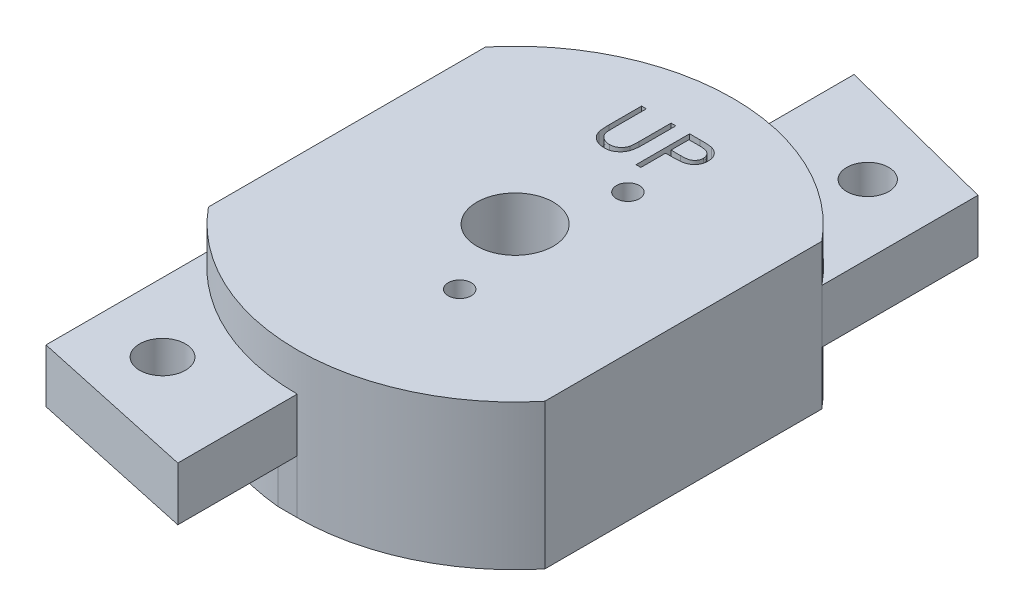
from build123d import *

# Parameters (mm, degrees)
SKETCH1_R           = 2.5
SKETCH1_R_2         = 0.75
BOSS_EXTRUDE1_DEPTH = 6
SKETCH2_R           = 1.373718665
SKETCH2_R_2         = 1.5
BOSS_EXTRUDE4_DEPTH = 3.5
CUT_EXTRUDE1_DEPTH  = 1
SKETCH6_R           = 0.75
SKETCH6_R_2         = 2.5
BOSS_EXTRUDE6_DEPTH = 3.5


with BuildPart() as part:
    # Sketch1 → Boss-Extrude1 (new body)
    with BuildSketch(Plane(origin=(0, 0, 0), x_dir=(1, 0, 0), z_dir=(0, 1, 0))):
        with BuildLine():
            Line((0, 5.191164534), (0, 23.308835466))
            ThreePointArc((0, 23.308835466), (11, 28.5), (22, 23.308835466))
            Line((22, 23.308835466), (22, 5.191164534))
            ThreePointArc((22, 5.191164534), (11, 0), (0, 5.191164534))
        make_face()
        with Locations(Location((11, 14.25, 0), (0, 0, 270))):
            Circle(SKETCH1_R, mode=Mode.SUBTRACT)
        with Locations(Location((12.875414144, 8.75, 0), (0, 0, 270))):
            Circle(SKETCH1_R_2, mode=Mode.SUBTRACT)
        with Locations(Location((12.875414144, 19.75, 0), (0, 0, 270))):
            Circle(SKETCH1_R_2, mode=Mode.SUBTRACT)
    extrude(amount=BOSS_EXTRUDE1_DEPTH)

    # Sketch2 → Boss-Extrude4 (add)
    # profile 1 of 2: a face of its own
    with BuildSketch(Plane(origin=(0, 0, 0), x_dir=(1, 0, 0), z_dir=(0, 1, 0))):
        with BuildLine():
            ThreePointArc((22, 23.308835466), (17.1460404, 27.154557663), (11.107071071, 28.526181686))
            Line((11.107071071, 28.526181686), (11.107071071, 36.308835466))
            Line((11.107071071, 36.308835466), (22, 33.519158942))
            Line((22, 33.519158942), (22, 23.308835466))
        make_face()
        with Locations(Location((17.5, 30.808835466, 0), (0, 0, 270))):
            Circle(SKETCH2_R, mode=Mode.SUBTRACT)
    # profile 2 of 2: a face of its own
    with BuildSketch(Plane(origin=(0, 0, 0), x_dir=(1, 0, 0), z_dir=(0, 1, 0))):
        with BuildLine():
            Line((0, -5.429149349), (11, -7.808835466))
            Line((11, -7.808835466), (11, 0))
            ThreePointArc((11, 0), (4.93641478, 1.373255983), (0, 5.152767438))
            Line((0, 5.152767438), (0, -5.429149349))
        make_face()
        with Locations(Location((4.5, -2.308835466, 0), (0, 0, 270))):
            Circle(SKETCH2_R_2, mode=Mode.SUBTRACT)
    extrude(amount=BOSS_EXTRUDE4_DEPTH)


with BuildPart() as boss_extrude4_piece_1:
    # of the separate pieces the step leaves, piece 1, a body of its own (boss_extrude4_pieces)
    add(part.part.solids().sort_by_distance((0, 0, -5.191164534))[0])

    # Sketch4 → Cut-Extrude1 (cut)
    # profile 1 of 2: a face of its own
    with BuildSketch(Plane(origin=(0, 6, 0), x_dir=(1, 0, 0), z_dir=(0, 1, 0))):
        with BuildLine():
            Line((8.446641059, 25.071391599), (8.760743623, 25.071391599))
            Line((8.760743623, 25.071391599), (8.760743623, 22.974336311))
            add(Edge.make_bspline(
                [(8.760743623, 22.974336311), (8.760696879, 22.944655575), (8.760608174, 22.888331264), (8.761200688, 22.808162964), (8.762860056, 22.736890505), (8.763906216, 22.674239157), (8.766233549, 22.620496409), (8.768131596, 22.575371099), (8.770572153, 22.539076896), (8.773505271, 22.51789597), (8.774766059, 22.508791439)],
                knots=[0, 0, 0, 0, 1.528628734, 2.90083645, 4.128790002, 5.200304208, 6.127813768, 6.898992206, 7.526736466, 8, 8, 8, 8], degree=3))
            add(Edge.make_bspline(
                [(8.774766059, 22.508791439), (8.779943517, 22.475944676), (8.790006704, 22.412101947), (8.815653082, 22.321193665), (8.851470583, 22.239262206), (8.893913625, 22.163750915), (8.949846237, 22.096761555), (9.016849772, 22.035049902), (9.09802754, 21.981078098), (9.188288146, 21.931727286), (9.285573384, 21.892062204), (9.38498465, 21.862068839), (9.485027629, 21.843789939), (9.552003794, 21.841673401), (9.585262854, 21.840622368)],
                knots=[0, 0, 0, 0, 1.035780045, 2.013197591, 2.933192213, 3.817615948, 4.702609284, 5.640816605, 6.646850145, 7.73207398, 8.84249596, 9.914020372, 10.964143139, 12, 12, 12, 12], degree=3))
            add(Edge.make_bspline(
                [(9.585262854, 21.840622368), (9.613816594, 21.841696219), (9.670759156, 21.843837717), (9.755365586, 21.857099148), (9.837765695, 21.880999714), (9.918366375, 21.911839472), (9.993917359, 21.952587063), (10.064460801, 21.999657903), (10.127424736, 22.054868779), (10.184882734, 22.115969123), (10.234917669, 22.184908923), (10.278288811, 22.260187061), (10.313814741, 22.342936408), (10.331358265, 22.40109083), (10.340371027, 22.43096692)],
                knots=[0, 0, 0, 0, 0.994687771, 1.983630487, 2.973142513, 3.978332533, 4.983357753, 5.956394766, 6.925816176, 7.893390482, 8.871859704, 9.88551698, 10.913711441, 12, 12, 12, 12], degree=3))
            add(Edge.make_bspline(
                [(10.340371027, 22.43096692), (10.343371152, 22.443315494), (10.35005664, 22.470833094), (10.356303685, 22.517354385), (10.36281021, 22.572243749), (10.36732478, 22.635895562), (10.371726001, 22.708096534), (10.374359074, 22.789222792), (10.375576107, 22.878979752), (10.375938787, 22.941616914), (10.376128238, 22.974336311)],
                knots=[0, 0, 0, 0, 0.558680831, 1.244966039, 2.062412453, 2.990489873, 4.051219941, 5.244515665, 6.560634259, 8, 8, 8, 8], degree=3))
            Line((10.376128238, 22.974336311), (10.376128238, 25.071391599))
            Line((10.376128238, 25.071391599), (10.690230802, 25.071391599))
            Line((10.690230802, 25.071391599), (10.690230802, 22.957509388))
            add(Edge.make_bspline(
                [(10.690230802, 22.957509388), (10.689976682, 22.919411009), (10.68948075, 22.845059706), (10.685180174, 22.736108347), (10.678323174, 22.632755366), (10.668635086, 22.534986869), (10.655798083, 22.44315271), (10.641522862, 22.356447942), (10.623343329, 22.275494949), (10.602109928, 22.199662531), (10.57783638, 22.127477018), (10.546395232, 22.058968403), (10.510970732, 21.992054004), (10.468956079, 21.927745895), (10.421744696, 21.865759342), (10.368293016, 21.806470267), (10.310368855, 21.74893122), (10.247009295, 21.694618154), (10.17925877, 21.644809477), (10.107318812, 21.601011706), (10.031742042, 21.563988089), (9.952724916, 21.533512164), (9.870233713, 21.510597565), (9.784266354, 21.493522409), (9.69462716, 21.483820112), (9.633662504, 21.482378182), (9.602790898, 21.48164801)],
                knots=[0, 0, 0, 0, 1.316592851, 2.569410997, 3.76748051, 4.895814652, 5.963796859, 6.97159953, 7.931736103, 8.829262218, 9.692595152, 10.560224239, 11.431080259, 12.30701507, 13.211635791, 14.121146779, 15.063487852, 16.031507147, 17.00238618, 17.966455255, 18.938106653, 19.907068911, 20.888905087, 21.893141452, 22.933117798, 24, 24, 24, 24], degree=3))
            add(Edge.make_bspline(
                [(9.602790898, 21.48164801), (9.569121796, 21.482432775), (9.503063137, 21.483972481), (9.40572507, 21.492795232), (9.312410873, 21.509413626), (9.222134996, 21.53057357), (9.136126499, 21.559757307), (9.053233055, 21.593855432), (8.974874374, 21.635732692), (8.899779245, 21.682326085), (8.829954489, 21.734750723), (8.765857086, 21.791890897), (8.707381215, 21.852831275), (8.655512519, 21.91823164), (8.609391634, 21.987583347), (8.569661421, 22.061082587), (8.535548177, 22.138700903), (8.51794161, 22.192654104), (8.509040898, 22.21992926)],
                knots=[0, 0, 0, 0, 1.13879206, 2.234305948, 3.301075583, 4.341971843, 5.366689343, 6.369221514, 7.369726634, 8.367512178, 9.355451585, 10.318319045, 11.268648973, 12.207971039, 13.137398894, 14.081662264, 15.030215811, 16, 16, 16, 16], degree=3))
            add(Edge.make_bspline(
                [(8.509040898, 22.21992926), (8.50386374, 22.238561834), (8.492634369, 22.278976303), (8.480609071, 22.345862791), (8.47049999, 22.422877709), (8.460994431, 22.510026327), (8.455385473, 22.607376194), (8.450468035, 22.71488511), (8.446606416, 22.832683072), (8.446629188, 22.914737587), (8.446641059, 22.957509388)],
                knots=[0, 0, 0, 0, 0.625038921, 1.35572334, 2.194682327, 3.136881307, 4.189498639, 5.346923369, 6.617055217, 8, 8, 8, 8], degree=3))
            Line((8.446641059, 22.957509388), (8.446641059, 25.071391599))
        make_face()
    # profile 2 of 2: a face of its own
    with BuildSketch(Plane(origin=(0, 6, 0), x_dir=(1, 0, 0), z_dir=(0, 1, 0))):
        with BuildLine():
            Line((11.5876667, 25.071391599), (12.274064937, 25.071391599))
            add(Edge.make_bspline(
                [(12.274064937, 25.071391599), (12.321275843, 25.071339703), (12.411734036, 25.071240268), (12.541449092, 25.068225522), (12.659258823, 25.06419883), (12.764909204, 25.058616936), (12.858725302, 25.052020346), (12.940282602, 25.042768307), (13.010222158, 25.033108011), (13.052128607, 25.023286605), (13.071240418, 25.018807465)],
                knots=[0, 0, 0, 0, 1.415646017, 2.712440637, 3.8905458, 4.950247383, 5.884950622, 6.709939814, 7.411656543, 8, 8, 8, 8], degree=3))
            add(Edge.make_bspline(
                [(13.071240418, 25.018807465), (13.095433951, 25.012185515), (13.143250929, 24.999097653), (13.212151972, 24.97288393), (13.277705817, 24.941801764), (13.340137376, 24.906377825), (13.398679459, 24.86509226), (13.4542055, 24.819618643), (13.50622548, 24.768907074), (13.554446872, 24.713526334), (13.598731669, 24.654406124), (13.636861352, 24.590663894), (13.668788579, 24.523372591), (13.696171851, 24.45257902), (13.715880305, 24.377688696), (13.730727205, 24.299221984), (13.740150832, 24.217187294), (13.741053394, 24.161127426), (13.741512854, 24.132589516)],
                knots=[0, 0, 0, 0, 0.999701418, 1.975846123, 2.934577507, 3.890451536, 4.834027766, 5.787354733, 6.749476667, 7.726910423, 8.712836071, 9.690891519, 10.682875813, 11.679750201, 12.712814741, 13.765529915, 14.8625177, 16, 16, 16, 16], degree=3))
            add(Edge.make_bspline(
                [(13.741512854, 24.132589516), (13.741091429, 24.103811739), (13.740266883, 24.047506075), (13.730370598, 23.965133287), (13.717040406, 23.886414897), (13.696543354, 23.811525446), (13.66969768, 23.740909676), (13.638205628, 23.673488444), (13.600222097, 23.610408772), (13.556577268, 23.551441654), (13.508025673, 23.496531742), (13.454772735, 23.446076948), (13.397033443, 23.400372609), (13.334991294, 23.359316266), (13.268041446, 23.323859986), (13.197199292, 23.292102681), (13.121849076, 23.26543162), (13.069706562, 23.251401559), (13.043195546, 23.244268202)],
                knots=[0, 0, 0, 0, 1.121902311, 2.195077645, 3.232258892, 4.234102512, 5.217864754, 6.176164875, 7.132989551, 8.084763148, 9.034132444, 9.988522005, 10.94243251, 11.903244335, 12.886203696, 13.894208494, 14.929344452, 16, 16, 16, 16], degree=3))
            add(Edge.make_bspline(
                [(13.043195546, 23.244268202), (13.021268212, 23.239605221), (12.973213184, 23.229386027), (12.894070462, 23.21797757), (12.801925076, 23.208239969), (12.696902796, 23.200938831), (12.579097892, 23.194688463), (12.448446634, 23.189720369), (12.304692557, 23.186990515), (12.204421313, 23.186849722), (12.152069745, 23.186776215)],
                knots=[0, 0, 0, 0, 0.601384939, 1.31797006, 2.144135048, 3.087295005, 4.142315834, 5.309527816, 6.595305764, 8, 8, 8, 8], degree=3))
            Line((12.152069745, 23.186776215), (11.901769264, 23.186776215))
            Line((11.901769264, 23.186776215), (11.901769264, 21.571391599))
            Line((11.901769264, 21.571391599), (11.5876667, 21.571391599))
            Line((11.5876667, 21.571391599), (11.5876667, 25.071391599))
        make_face()
        with BuildLine():
            Line((11.901769264, 24.71241724), (11.901769264, 23.545750574))
            Line((11.901769264, 23.545750574), (12.514549712, 23.538038234))
            add(Edge.make_bspline(
                [(12.514549712, 23.538038234), (12.544469638, 23.53802277), (12.602229438, 23.537992918), (12.685665661, 23.541978142), (12.763074949, 23.546578674), (12.834219524, 23.553314598), (12.899131459, 23.562835855), (12.957918988, 23.572447593), (13.01012627, 23.586352956), (13.071225472, 23.605076025), (13.13930882, 23.637008641), (13.213376368, 23.683358531), (13.276146955, 23.742439239), (13.330465251, 23.80886707), (13.373571129, 23.8827662), (13.405127122, 23.961835136), (13.423668279, 24.045262986), (13.426154473, 24.102351125), (13.427410289, 24.131187272)],
                knots=[0, 0, 0, 0, 1.160613943, 2.240541288, 3.23993089, 4.169200891, 5.011653406, 5.7853311, 6.478053781, 7.106038997, 8.262395093, 9.384106736, 10.481365981, 11.59014053, 12.70357646, 13.786202915, 14.881775077, 16, 16, 16, 16], degree=3))
            add(Edge.make_bspline(
                [(13.427410289, 24.131187272), (13.426147643, 24.159325786), (13.423637658, 24.215261668), (13.404981795, 24.297240429), (13.373632481, 24.375476133), (13.330175886, 24.448449218), (13.277434756, 24.514638022), (13.216135413, 24.572135149), (13.146422152, 24.618356852), (13.081573921, 24.648190134), (13.023972735, 24.666405409), (12.973940775, 24.67915025), (12.917450101, 24.689325856), (12.854482321, 24.697565359), (12.785525487, 24.70461882), (12.709987172, 24.709404797), (12.628153529, 24.712206253), (12.571342958, 24.712345209), (12.541893462, 24.71241724)],
                knots=[0, 0, 0, 0, 1.120700087, 2.227813068, 3.331159281, 4.466773991, 5.599788987, 6.693661531, 7.80175334, 8.91857717, 9.525282508, 10.207424825, 10.974604443, 11.810962634, 12.737642355, 13.736264703, 14.826523623, 16, 16, 16, 16], degree=3))
            Line((12.541893462, 24.71241724), (11.901769264, 24.71241724))
        make_face(mode=Mode.SUBTRACT)
    extrude(amount=-CUT_EXTRUDE1_DEPTH, mode=Mode.SUBTRACT)

    # Sketch6 → Boss-Extrude6 (add)
    with BuildSketch(Plane.XZ):
        with BuildLine():
            ThreePointArc((22, -5.191164534), (17.081697732, -1.362973473), (11, 0))
            Line((11, 0), (9.752952518, 0))
            ThreePointArc((9.752952518, 0), (4.362038706, -1.583134835), (0, -5.124446168))
            Line((0, -5.124446168), (0, -5.152767438))
            ThreePointArc((0, -5.152767438), (0.901977749, -4.179926091), (1.888834821, -3.293304828))
            ThreePointArc((1.888834821, -3.293304828), (0.899742128, -4.197771843), (0, -5.191164534))
            Line((0, -5.191164534), (0, -23.308835466))
            ThreePointArc((0, -23.308835466), (4.362038706, -26.850146799), (9.752952518, -28.433281634))
            Line((9.752952518, -28.433281634), (12.247047482, -28.433281634))
            ThreePointArc((12.247047482, -28.433281634), (17.637961294, -26.850146799), (22, -23.308835466))
            Line((22, -23.308835466), (22, -5.191164534))
        make_face()
        with Locations(Location((12.875414144, -19.75, 0), (0, 0, 270))):
            Circle(SKETCH6_R, mode=Mode.SUBTRACT)
        with Locations(Location((11, -14.25, 0), (0, 0, 270))):
            Circle(SKETCH6_R_2, mode=Mode.SUBTRACT)
        with Locations(Location((12.875414144, -8.75, 0), (0, 0, 270))):
            Circle(SKETCH6_R, mode=Mode.SUBTRACT)
    extrude(amount=BOSS_EXTRUDE6_DEPTH)


with BuildPart() as boss_extrude4_piece_2:
    # of the separate pieces the step leaves, piece 2, a body of its own (boss_extrude4_pieces)
    add(part.part.solids().sort_by_distance((11.107071071, 0, -28.526181686))[0])


solid = Compound([boss_extrude4_piece_1.part, boss_extrude4_piece_2.part])
